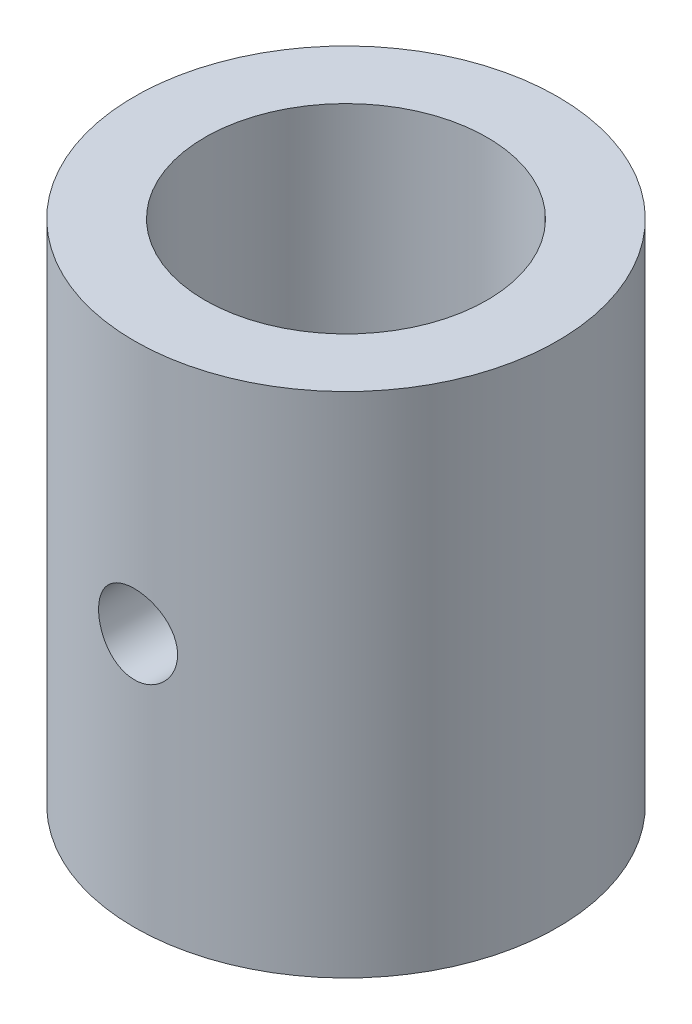
from build123d import *

# Parameters (mm, degrees)
SKETCH1_R                 = 4.7625
SKETCH1_R_2               = 3.175
BOSS_EXTRUDE1_DEPTH       = 11.43
F_2_56_TAPPED_HOLE1_D     = 1.778
F_2_56_TAPPED_HOLE1_DEPTH = 5.588
F_2_56_TAPPED_HOLE1_TIP   = 0.53416509


with BuildPart() as part:
    # Sketch1 → Boss-Extrude1 (new body)
    with BuildSketch(Plane(origin=(0, 0, 0), x_dir=(1, 0, 0), z_dir=(0, 1, 0))):
        with Locations(Location((0, 0, 0), (0, 0, 270))):
            Circle(SKETCH1_R)
        with Locations(Location((0, 0, 0), (0, 0, 270))):
            Circle(SKETCH1_R_2, mode=Mode.SUBTRACT)
    extrude(amount=BOSS_EXTRUDE1_DEPTH)

    # #2-56 Tapped Hole1
    with Locations(Plane.XY.offset(4.7625)):
        with Locations((0, 5.715)):
            Hole(F_2_56_TAPPED_HOLE1_D / 2, depth=F_2_56_TAPPED_HOLE1_DEPTH)
            with Locations((0, 0, -(F_2_56_TAPPED_HOLE1_DEPTH + F_2_56_TAPPED_HOLE1_TIP / 2))):  # 118° drill point
                Cone(0, F_2_56_TAPPED_HOLE1_D / 2, F_2_56_TAPPED_HOLE1_TIP, mode=Mode.SUBTRACT)


solid = part.part
